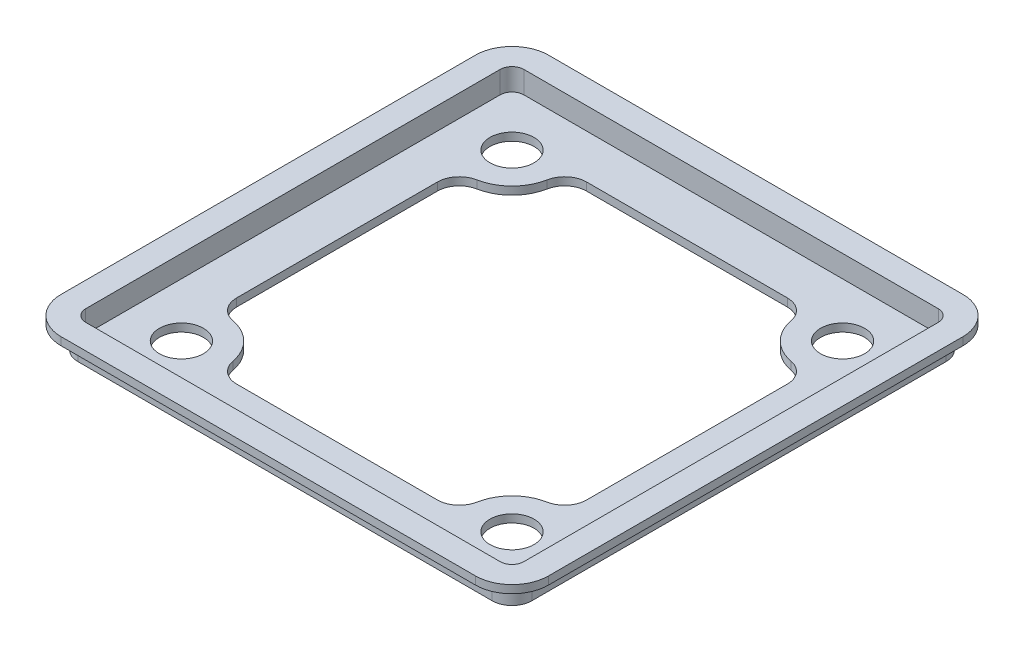
from build123d import *

# Parameters (mm, degrees)
SKETCH1_W           = 103
SKETCH1_H           = 103
SKETCH1_R           = 5
BOSS_EXTRUDE1_DEPTH = 1.8
SKETCH2_W           = 103
SKETCH2_H           = 103
SKETCH2_W_2         = 99.4
SKETCH2_H_2         = 99.4
BOSS_EXTRUDE2_DEPTH = 6.8
FILLET1_R           = 4.5
SKETCH3_W           = 99.4
SKETCH3_H           = 99.4
BOSS_EXTRUDE3_DEPTH = 1.8
FILLET3_R           = 2.7
CUT_EXTRUDE2_DEPTH  = 79.365681264


with BuildPart() as part:
    # Sketch1 → Boss-Extrude1 (new body)
    with BuildSketch(Plane(origin=(0, 0, 0), x_dir=(1, 0, 0), z_dir=(0, 1, 0))):
        Rectangle(SKETCH1_W, SKETCH1_H)
        with Locations(Location((-37.5, 37.5, 0), (0, 0, 270))):
            Circle(SKETCH1_R, mode=Mode.SUBTRACT)
        with Locations(Location((37.5, 37.5, 0), (0, 0, 90))):
            Circle(SKETCH1_R, mode=Mode.SUBTRACT)
        with Locations(Location((37.5, -37.5, 0), (0, 0, 270))):
            Circle(SKETCH1_R, mode=Mode.SUBTRACT)
        with Locations(Location((-37.5, -37.5, 0), (0, 0, 90))):
            Circle(SKETCH1_R, mode=Mode.SUBTRACT)
    extrude(amount=BOSS_EXTRUDE1_DEPTH)

    # Sketch2 → Boss-Extrude2 (add)
    with BuildSketch(Plane.XZ):
        Rectangle(SKETCH2_W, SKETCH2_H)
        Rectangle(SKETCH2_W_2, SKETCH2_H_2, mode=Mode.SUBTRACT)
    extrude(amount=-BOSS_EXTRUDE2_DEPTH)

    # Fillet1
    fillet1_edges = [part.edges().sort_by_distance(p)[0] for p in [
        (51.5, 3.4, 51.5),
        (-51.5, 3.4, 51.5),
        (-51.5, 3.4, -51.5),
        (51.5, 3.4, -51.5),
    ]]
    fillet(fillet1_edges, radius=FILLET1_R)

    # Sketch3 → Boss-Extrude3 (add)
    with BuildSketch(Plane(origin=(0, 6.8, 0), x_dir=(1, 0, 0), z_dir=(0, 1, 0))):
        with BuildLine():
            Line((47, 55.3), (-47, 55.3))
            ThreePointArc((-47, 55.3), (-52.868986284, 52.868986284), (-55.3, 47))
            Line((-55.3, 47), (-55.3, -47))
            ThreePointArc((-55.3, -47), (-52.868986284, -52.868986284), (-47, -55.3))
            Line((-47, -55.3), (47, -55.3))
            ThreePointArc((47, -55.3), (52.868986284, -52.868986284), (55.3, -47))
            Line((55.3, -47), (55.3, 47))
            ThreePointArc((55.3, 47), (52.868986284, 52.868986284), (47, 55.3))
        make_face()
        Rectangle(SKETCH3_W, SKETCH3_H, mode=Mode.SUBTRACT)
    extrude(amount=-BOSS_EXTRUDE3_DEPTH)

    # Fillet3
    fillet3_edges = [part.edges().sort_by_distance(p)[0] for p in [
        (-49.7, 4.3, 49.7),
        (-49.7, 4.3, -49.7),
        (49.7, 4.3, -49.7),
        (49.7, 4.3, 49.7),
    ]]
    fillet(fillet3_edges, radius=FILLET3_R)

    # Sketch5 → Cut-Extrude2 (cut, through all)
    with BuildSketch(Plane(origin=(0, 1.8, 0), x_dir=(1, 0, 0), z_dir=(0, 1, 0))):
        with BuildLine():
            Line((22.763650384, 39.7), (-22.763650384, 39.7))
            ThreePointArc((-22.763650384, 39.7), (-25.952171462, 38.551406669), (-27.675766923, 35.633333333))
            ThreePointArc((-27.675766923, 35.633333333), (-30.428932188, 30.428932188), (-35.633333333, 27.675766923))
            ThreePointArc((-35.633333333, 27.675766923), (-38.551406669, 25.952171462), (-39.7, 22.763650384))
            Line((-39.7, 22.763650384), (-39.7, -22.763650384))
            ThreePointArc((-39.7, -22.763650384), (-38.551406669, -25.952171462), (-35.633333333, -27.675766923))
            ThreePointArc((-35.633333333, -27.675766923), (-30.428932188, -30.428932188), (-27.675766923, -35.633333333))
            ThreePointArc((-27.675766923, -35.633333333), (-25.952171462, -38.551406669), (-22.763650384, -39.7))
            Line((-22.763650384, -39.7), (22.763650384, -39.7))
            ThreePointArc((22.763650384, -39.7), (25.952171462, -38.551406669), (27.675766923, -35.633333333))
            ThreePointArc((27.675766923, -35.633333333), (30.428932188, -30.428932188), (35.633333333, -27.675766923))
            ThreePointArc((35.633333333, -27.675766923), (38.551406669, -25.952171462), (39.7, -22.763650384))
            Line((39.7, -22.763650384), (39.7, 22.763650384))
            ThreePointArc((39.7, 22.763650384), (38.551406669, 25.952171462), (35.633333333, 27.675766923))
            ThreePointArc((35.633333333, 27.675766923), (30.428932188, 30.428932188), (27.675766923, 35.633333333))
            ThreePointArc((27.675766923, 35.633333333), (25.952171462, 38.551406669), (22.763650384, 39.7))
        make_face()
    extrude(amount=-CUT_EXTRUDE2_DEPTH, mode=Mode.SUBTRACT)


solid = part.part
